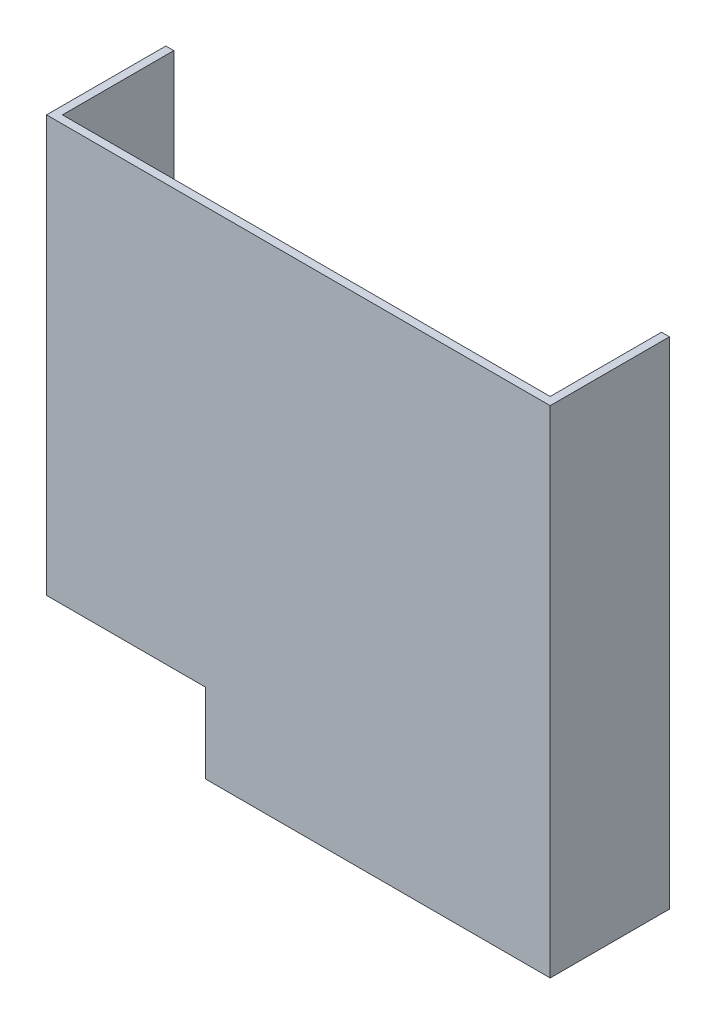
from build123d import *

# Parameters (mm, degrees)
CROQUIS1_W              = 190
CROQUIS1_H              = 190
SALIENTE_EXTRUIR1_DEPTH = 45
VACIADO1_T              = -3
CROQUIS4_W              = 60
CROQUIS4_H              = 30
CORTAR_EXTRUIR1_DEPTH   = 226.78881097
CROQUIS7_W              = 190
CROQUIS7_H              = 45
CORTAR_EXTRUIR2_DEPTH   = 3


with BuildPart() as part:
    # Croquis1 → Saliente-Extruir1 (new body)
    with BuildSketch(Plane.XY):
        with Locations((56.932555838, -65.848020305)):
            Rectangle(CROQUIS1_W, CROQUIS1_H)
    extrude(amount=-SALIENTE_EXTRUIR1_DEPTH)

    # Vaciado1
    vaciado1_openings = [part.faces().sort_by_distance(p)[0] for p in [
        (56.932555838, -65.848020305, -45),
    ]]
    offset(amount=VACIADO1_T, openings=vaciado1_openings, kind=Kind.INTERSECTION)

    # Croquis4 → Cortar-Extruir1 (cut, through all)
    with BuildSketch(Plane.XY):
        with Locations((-8.067444162, -145.848020305)):
            Rectangle(CROQUIS4_W, CROQUIS4_H)
    extrude(amount=-CORTAR_EXTRUIR1_DEPTH, mode=Mode.SUBTRACT)

    # Croquis7 → Cortar-Extruir2 (cut)
    with BuildSketch(Plane(origin=(0, 29.151979695, 0), x_dir=(1, 0, 0), z_dir=(0, 1, 0))):
        with Locations((56.932555838, 22.5)):
            Rectangle(CROQUIS7_W, CROQUIS7_H)
    extrude(amount=-CORTAR_EXTRUIR2_DEPTH, mode=Mode.SUBTRACT)


solid = part.part
